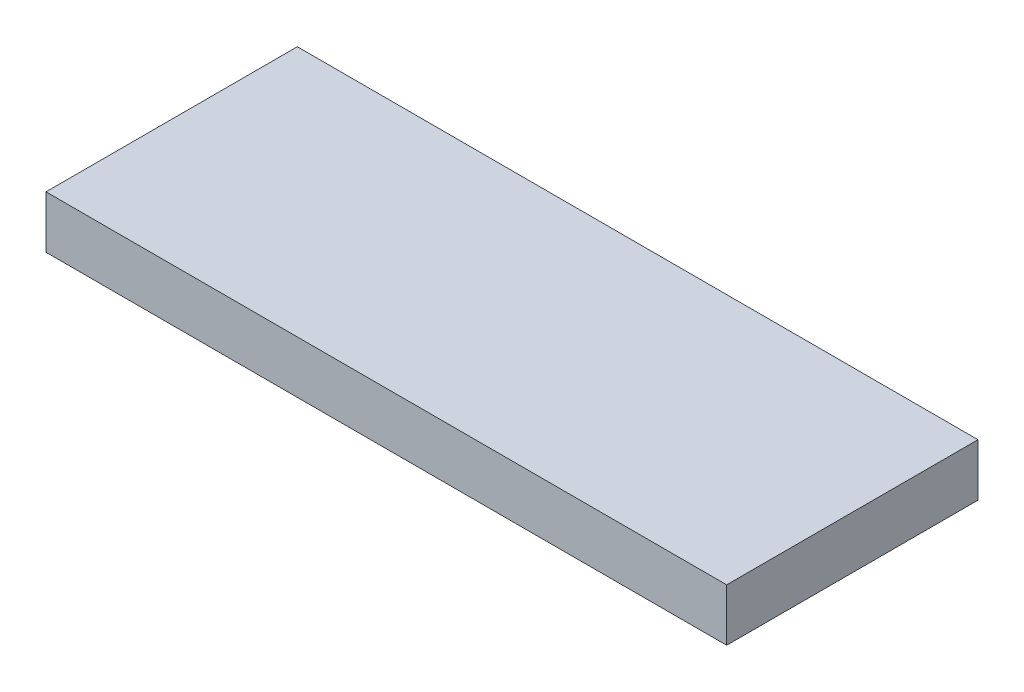
from build123d import *

# Parameters (mm, degrees)
SKETCH1_W           = 13
SKETCH1_H           = 4.8
BOSS_EXTRUDE1_DEPTH = 1


with BuildPart() as part:
    # Sketch1 → Boss-Extrude1 (new body)
    with BuildSketch(Plane(origin=(0, 0, 0), x_dir=(1, 0, 0), z_dir=(0, 1, 0))):
        Rectangle(SKETCH1_W, SKETCH1_H)
    extrude(amount=BOSS_EXTRUDE1_DEPTH)


solid = part.part
